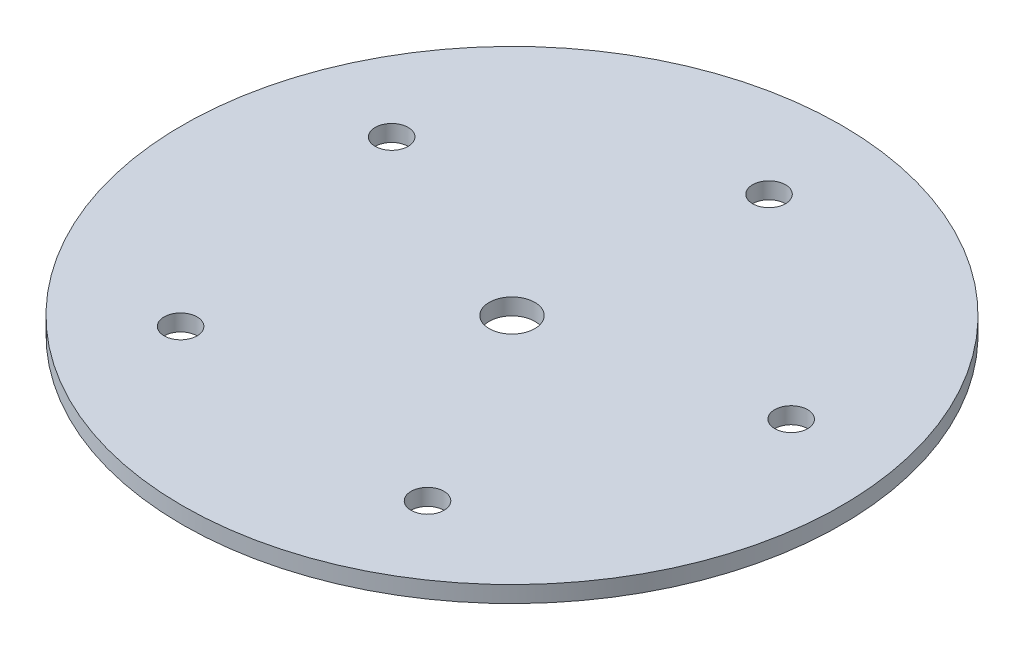
from build123d import *

# Parameters (mm, degrees)
SKETCH1_R           = 60
BOSS_EXTRUDE1_DEPTH = 3
SKETCH2_R           = 4.15
CUT_EXTRUDE1_DEPTH  = 5
SKETCH3_R           = 3
CUT_EXTRUDE2_DEPTH  = 10


with BuildPart() as part:
    # Sketch1 → Boss-Extrude1 (new body)
    with BuildSketch(Plane(origin=(0, 0, 0), x_dir=(1, 0, 0), z_dir=(0, 1, 0))):
        with Locations(Location((0, 0, 0), (0, 0, 270))):
            Circle(SKETCH1_R)
    extrude(amount=BOSS_EXTRUDE1_DEPTH)

    # Sketch2 → Cut-Extrude1 (cut)
    with BuildSketch(Plane(origin=(0, 3, 0), x_dir=(1, 0, 0), z_dir=(0, 1, 0))):
        with Locations(Location((0, 0, 0), (0, 0, 270))):
            Circle(SKETCH2_R)
    extrude(amount=-CUT_EXTRUDE1_DEPTH, mode=Mode.SUBTRACT)

    # Sketch3 → Cut-Extrude2 (cut)
    with BuildSketch(Plane(origin=(0, 3, 0), x_dir=(1, 0, 0), z_dir=(0, 1, 0))):
        with Locations(Location((-28.451614764, -31.883278826, 0), (0, 0, 270))):
            Circle(SKETCH3_R)
        with Locations(Location((-39.114832567, 17.206618627, 0), (0, 0, 270))):
            Circle(SKETCH3_R)
        with Locations(Location((4.277318773, 42.517553969, 0), (0, 0, 270))):
            Circle(SKETCH3_R)
        with Locations(Location((41.75836095, 9.070674844, 0), (0, 0, 270))):
            Circle(SKETCH3_R)
        with Locations(Location((21.530767608, -36.911568614, 0), (0, 0, 270))):
            Circle(SKETCH3_R)
    extrude(amount=-CUT_EXTRUDE2_DEPTH, mode=Mode.SUBTRACT)


solid = part.part
